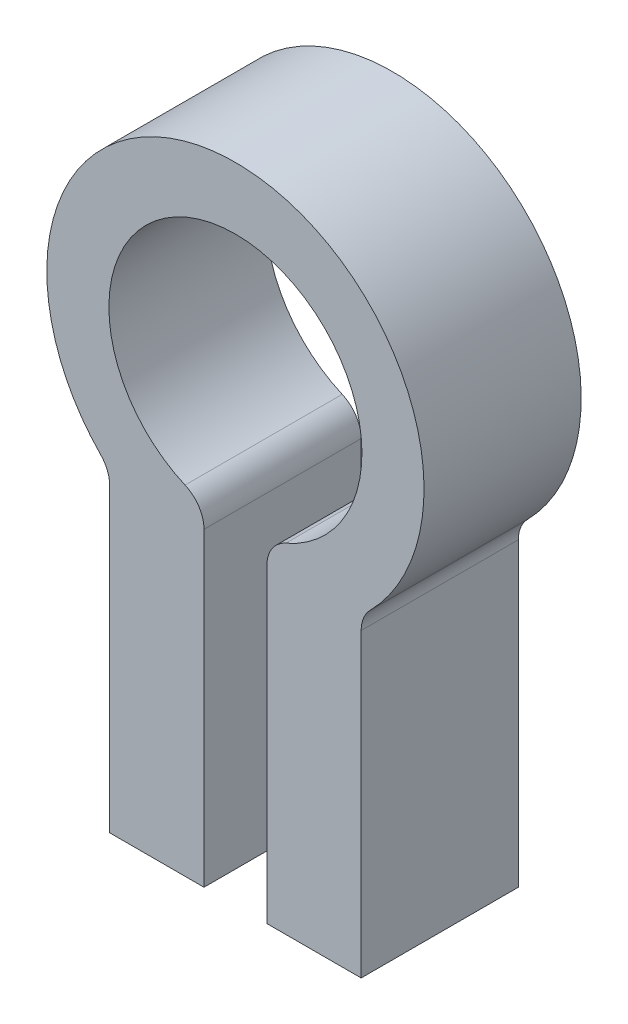
from build123d import *

# Parameters (mm, degrees)
BOSS_EXTRUDE1_DEPTH = 5
FILLET1_R           = 1


with BuildPart() as part:
    # Sketch1 → Boss-Extrude1 (new body)
    with BuildSketch(Plane.XY):
        with BuildLine():
            Line((-1, -3.898797892), (-1, -14.472135955))
            Line((-1, -14.472135955), (-4, -14.472135955))
            Line((-4, -14.472135955), (-4, -4.472135955))
            ThreePointArc((-4, -4.472135955), (0, 6), (4, -4.472135955))
            Line((4, -4.472135955), (4, -14.472135955))
            Line((4, -14.472135955), (1, -14.472135955))
            Line((1, -14.472135955), (1, -3.898797892))
            ThreePointArc((1, -3.898797892), (0, 4.025), (-1, -3.898797892))
        make_face()
    extrude(amount=BOSS_EXTRUDE1_DEPTH)

    # Fillet1
    fillet1_edges = [part.edges().sort_by_distance(p)[0] for p in [
        (-1, -3.898797892, 2.5),
        (-4, -4.472135955, 2.5),
        (4, -4.472135955, 2.5),
        (1, -3.898797892, 2.5),
    ]]
    fillet(fillet1_edges, radius=FILLET1_R)


solid = part.part
